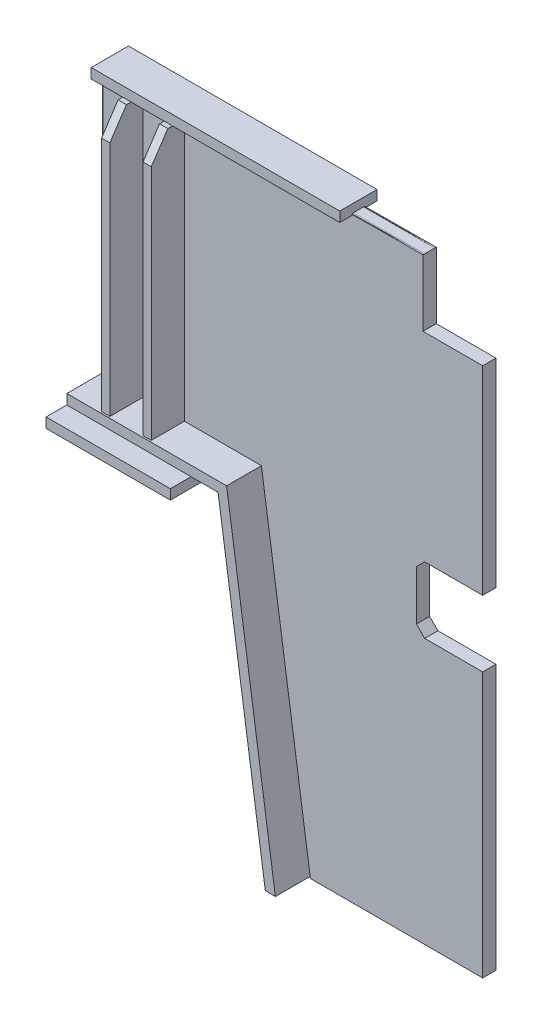
from build123d import *

# Parameters (mm, degrees)
SKETCH_1_R           = 13
SKETCH_1_R_2         = 37.5
EXTRUDE_1417_DEPTH   = 16
FILLET_1_R           = 2
FILLET_2_R           = 2
EXTRUDE_2_DEPTH      = 40
EXTRUDE_2_DEPTH_BACK = 56
SKETCH_3_W           = 10
SKETCH_3_H           = 316
CUT_EXTRUDE_1_DEPTH  = 836.425640018
CUT_EXTRUDE_2_DEPTH  = 836.425640018
EXTRUDE_5_DEPTH      = 42
EXTRUDE_5_DEPTH_BACK = 58
EXTRUDE_6_DEPTH      = 14.5
EXTRUDE_6_DEPTH_BACK = 30.5
SKETCH_7_W           = 300
SKETCH_7_H           = 12
SKETCH_8_W           = 150
SKETCH_8_H           = 150
EXTRUDE_7_DEPTH      = 12
EXTRUDE_8_DEPTH      = 16


with BuildPart() as part:
    # 草图1 → Extrude 1417 (new body)
    with BuildSketch(Plane.XY):
        with BuildLine():
            Line((0, -320), (-70, -320))
            ThreePointArc((-70, -320), (-77.071067812, -322.928932188), (-80, -330))
            Line((-80, -330), (-80, -390))
            ThreePointArc((-80, -390), (-77.071067812, -397.071067812), (-70, -400))
            Line((-70, -400), (0, -400))
            Line((0, -400), (0, -720))
            Line((0, -720), (-210, -720))
            Line((-210, -720), (-259.124034735, -327.007722123))
            ThreePointArc((-259.124034735, -327.007722123), (-261.767837242, -322.002574593), (-267.062257748, -320))
            Line((-267.062257748, -320), (-460, -320))
            Line((-460, -320), (-460, 0))
            Line((-460, 0), (-72, 0))
            Line((-72, 0), (-72, -80))
            Line((-72, -80), (0, -80))
            Line((0, -80), (0, -320))
        make_face()
        with Locations((-112, -40)):
            Circle(SKETCH_1_R, mode=Mode.SUBTRACT)
        with Locations((-112, -120)):
            Circle(SKETCH_1_R, mode=Mode.SUBTRACT)
        with Locations((-112, -200)):
            Circle(SKETCH_1_R, mode=Mode.SUBTRACT)
        with Locations((-112, -280)):
            Circle(SKETCH_1_R, mode=Mode.SUBTRACT)
        with Locations((-40, -160)):
            Circle(SKETCH_1_R, mode=Mode.SUBTRACT)
        with Locations((-40, -240)):
            Circle(SKETCH_1_R, mode=Mode.SUBTRACT)
        with Locations((-40, -680)):
            Circle(SKETCH_1_R, mode=Mode.SUBTRACT)
        with Locations((-40, -600)):
            Circle(SKETCH_1_R, mode=Mode.SUBTRACT)
        with Locations((-40, -520)):
            Circle(SKETCH_1_R, mode=Mode.SUBTRACT)
        with Locations((-112, -640)):
            Circle(SKETCH_1_R, mode=Mode.SUBTRACT)
        with Locations((-112, -560)):
            Circle(SKETCH_1_R, mode=Mode.SUBTRACT)
        with Locations((-112, -480)):
            Circle(SKETCH_1_R, mode=Mode.SUBTRACT)
        with Locations((-260, -110)):
            Circle(SKETCH_1_R_2, mode=Mode.SUBTRACT)
    extrude(amount=EXTRUDE_1417_DEPTH)

    # 圆角1
    fillet_1_edges = [part.edges().sort_by_distance(p)[0] for p in [
        (-105, -720, 16),
        (0, -560, 16),
        (-35, -400, 16),
        (-77.071067812, -397.071067812, 16),
        (-80, -360, 16),
        (-77.071067812, -322.928932188, 16),
        (-35, -320, 16),
        (0, -200, 16),
        (-36, -80, 16),
        (-125, -40, 16),
        (-72, -40, 16),
        (-261.767837242, -322.002574593, 16),
        (-266, 0, 16),
        (-125, -120, 16),
        (-460, -160, 16),
        (-125, -200, 16),
        (-363.531128874, -320, 16),
        (-125, -280, 16),
        (-53, -160, 16),
        (-53, -240, 16),
        (-53, -680, 16),
        (-53, -600, 16),
        (-53, -520, 16),
        (-234.562017367, -523.503861062, 16),
        (-125, -640, 16),
        (-125, -560, 16),
        (-125, -480, 16),
        (-297.5, -110, 16),
    ]]
    fillet(fillet_1_edges, radius=FILLET_1_R)

    # 圆角2
    fillet_2_edges = [part.edges().sort_by_distance(p)[0] for p in [
        (-363.531128874, -320, 0),
        (-460, -160, 0),
        (-266, 0, 0),
        (-72, -40, 0),
        (-36, -80, 0),
        (0, -200, 0),
        (-35, -320, 0),
        (-77.071067812, -322.928932188, 0),
        (-80, -360, 0),
        (-77.071067812, -397.071067812, 0),
        (-35, -400, 0),
        (0, -560, 0),
        (-105, -720, 0),
        (-234.562017367, -523.503861062, 0),
        (-261.767837242, -322.002574593, 0),
        (-125, -40, 0),
        (-125, -120, 0),
        (-125, -200, 0),
        (-125, -280, 0),
        (-53, -160, 0),
        (-53, -240, 0),
        (-53, -680, 0),
        (-53, -600, 0),
        (-53, -520, 0),
        (-125, -640, 0),
        (-125, -560, 0),
        (-125, -480, 0),
        (-297.5, -110, 0),
    ]]
    fillet(fillet_2_edges, radius=FILLET_2_R)

    # 草图3 → 凸台-拉伸2 (add, two sides: drawn at the far end of the back side and taken through both)
    with BuildSketch(Plane.XY.offset(16).offset(-EXTRUDE_2_DEPTH_BACK)):
        with Locations((-415, -160)):
            Rectangle(SKETCH_3_W, SKETCH_3_H)
        with Locations((-365, -160)):
            Rectangle(SKETCH_3_W, SKETCH_3_H)
    extrude(amount=EXTRUDE_2_DEPTH + EXTRUDE_2_DEPTH_BACK)

    # 草图4 → 切除-拉伸1 (cut, through all)
    with BuildSketch(Plane.ZY.offset(420)):
        Polygon((-20, -2), (-45.5, -32), (-45.5, -2), align=None)
    extrude(amount=-CUT_EXTRUDE_1_DEPTH, mode=Mode.SUBTRACT)

    # 草图5 → 切除-拉伸2 (cut, through all)
    with BuildSketch(Plane.ZY.offset(420)):
        Polygon((36, -2), (56, -32), (56, -2), align=None)
    extrude(amount=-CUT_EXTRUDE_2_DEPTH, mode=Mode.SUBTRACT)

    # 草图6 → 凸台-拉伸5 (add, two sides: drawn at the far end of the back side and taken through both)
    with BuildSketch(Plane.XY.offset(16).offset(-EXTRUDE_5_DEPTH_BACK)):
        Polygon((-267.062257748, -318), (-460, -318), (-460, -330), (-277.426505546, -330), (-220.363518026, -718), (-208.234435563, -718), align=None)
    extrude(amount=EXTRUDE_5_DEPTH + EXTRUDE_5_DEPTH_BACK)

    # 草图7 → 凸台-拉伸6 (add, two sides: drawn at the far end of the back side and taken through both)
    with BuildSketch(Plane(origin=(0, 0, 0), x_dir=(-1, 0, 0), z_dir=(0, 0, -1)).offset(-EXTRUDE_6_DEPTH_BACK)):
        with Locations((308, 4)):
            Rectangle(SKETCH_7_W, SKETCH_7_H)
    extrude(amount=EXTRUDE_6_DEPTH + EXTRUDE_6_DEPTH_BACK)

    # 草图8 → 凸台-拉伸7 (add)
    with BuildSketch(Plane.XZ.offset(330)):
        with Locations((-385, 8)):
            Rectangle(SKETCH_8_W, SKETCH_8_H)
    extrude(amount=EXTRUDE_7_DEPTH)

    # 草图9 → 凸台-拉伸8 (add)
    with BuildSketch(Plane.XY.offset(16)):
        Polygon((0, -720), (0, -400), (-70, -400), (-80, -390), (-80, -330), (-70, -320), (0, -320), (0, -80), (-72, -80), (-72, 0), (-360, -2), (-360, -318), (-267.062257748, -318), (-207.940296452, -720), align=None)
    extrude(amount=-EXTRUDE_8_DEPTH)


solid = part.part
